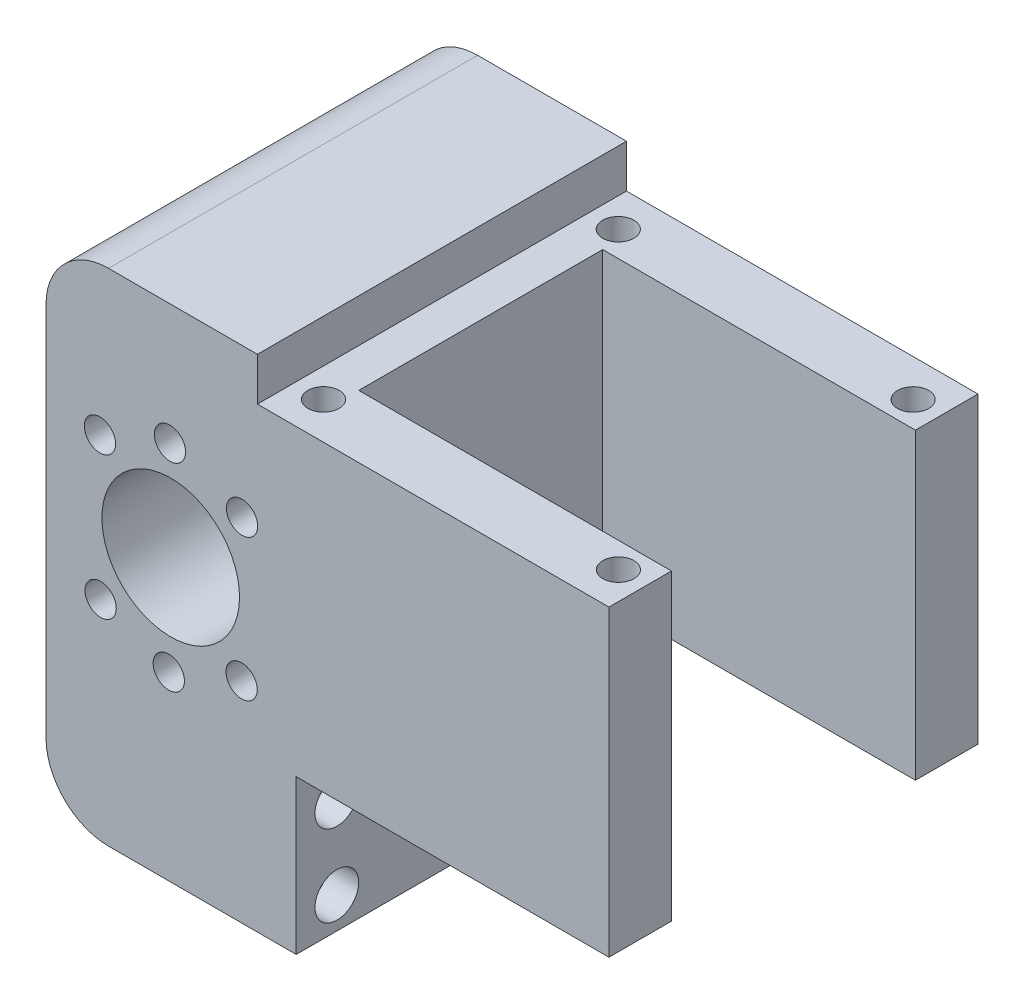
from build123d import *

# Parameters (mm, degrees)
SKETCH1_W                    = 40
SKETCH1_H                    = 80
BOSS_EXTRUDE1_DEPTH          = 59
SKETCH2_R                    = 11
SKETCH2_R_2                  = 2.5
CUT_EXTRUDE1_DEPTH           = 77.829612465
SKETCH5_R                    = 2.55
CUT_EXTRUDE3_DEPTH           = 5
FILLET3_R                    = 10
FILLET4_R                    = 10
F_7_0_7_DIAMETER_HOLE1_D     = 7
F_7_0_7_DIAMETER_HOLE1_DEPTH = 4.896987833
F_7_0_7_DIAMETER_HOLE1_TIP   = 2.103012167
SKETCH13_W                   = 10
SKETCH13_H                   = 48.48
BOSS_EXTRUDE2_DEPTH          = 50
SKETCH18_W                   = 6.2
SKETCH18_H                   = 6.9
CUT_EXTRUDE4_DEPTH           = 103.023881602
F_5_0_5_DIAMETER_HOLE1_D     = 5
F_5_0_5_DIAMETER_HOLE1_DEPTH = 18.497848452
F_5_0_5_DIAMETER_HOLE1_TIP   = 1.502151548


with BuildPart() as part:
    # Sketch1 → Boss-Extrude1 (new body)
    with BuildSketch(Plane.XY):
        with Locations((0.060830656, -4.937205352)):
            Rectangle(SKETCH1_W, SKETCH1_H)
    extrude(amount=BOSS_EXTRUDE1_DEPTH)

    # Sketch2 → Cut-Extrude1 (cut, through all)
    with BuildSketch(Plane.XY):
        Circle(SKETCH2_R)
        with Locations((-11.313708499, 11.313708499)):
            Circle(SKETCH2_R_2)
        with Locations((-0.122338904, 15.759725587)):
            Circle(SKETCH2_R_2)
        with Locations((11.402693442, 11.263696484)):
            Circle(SKETCH2_R_2)
        with Locations((11.339369089, -11.406422087)):
            Circle(SKETCH2_R_2)
        with Locations((-0.312311964, -16.029099896)):
            Circle(SKETCH2_R_2)
        with Locations((-11.204100775, -11.406422087)):
            Circle(SKETCH2_R_2)
    extrude(amount=CUT_EXTRUDE1_DEPTH, mode=Mode.SUBTRACT)

    # Sketch5 → Cut-Extrude3 (cut)
    with BuildSketch(Plane.ZY.offset(19.939169344)):
        with Locations((29.5, -4.937205352)):
            Circle(SKETCH5_R)
        with Locations((39.5, -4.937205352)):
            Circle(SKETCH5_R)
        with Locations((19.5, -4.937205352)):
            Circle(SKETCH5_R)
        with Locations((29.5, 5.062794648)):
            Circle(SKETCH5_R)
        with Locations((29.5, -14.937205352)):
            Circle(SKETCH5_R)
    extrude(amount=-CUT_EXTRUDE3_DEPTH, mode=Mode.SUBTRACT)

    # Fillet3
    fillet3_edges = [part.edges().sort_by_distance(p)[0] for p in [
        (-19.939169344, -44.937205352, 29.5),
    ]]
    fillet(fillet3_edges, radius=FILLET3_R)

    # Fillet4
    fillet4_edges = [part.edges().sort_by_distance(p)[0] for p in [
        (-19.939169344, 35.062794648, 29.5),
    ]]
    fillet(fillet4_edges, radius=FILLET4_R)

    # Ø7.0 (7) Diameter Hole1
    with Locations(Plane(origin=(20.060830656, 0, 0), x_dir=(0, 0, -1), z_dir=(1, 0, 0))):
        with Locations((-52.5, -26.937205352), (-52.5, -39.937205352), (-6.5, -39.937205352), (-6.5, -26.937205352)):
            Hole(F_7_0_7_DIAMETER_HOLE1_D / 2, depth=F_7_0_7_DIAMETER_HOLE1_DEPTH)
            with Locations((0, 0, -(F_7_0_7_DIAMETER_HOLE1_DEPTH + F_7_0_7_DIAMETER_HOLE1_TIP / 2))):  # 118° drill point
                Cone(0, F_7_0_7_DIAMETER_HOLE1_D / 2, F_7_0_7_DIAMETER_HOLE1_TIP, mode=Mode.SUBTRACT)

    # Sketch13 → Boss-Extrude2 (add)
    with BuildSketch(Plane(origin=(20.060830656, 0, 0), x_dir=(0, 0, -1), z_dir=(1, 0, 0))):
        with Locations((-5, 3.922794648)):
            Rectangle(SKETCH13_W, SKETCH13_H)
        with Locations((-54, 3.922794648)):
            Rectangle(SKETCH13_W, SKETCH13_H)
    extrude(amount=BOSS_EXTRUDE2_DEPTH)

    # Sketch18 → Cut-Extrude4 (cut, through all)
    with BuildSketch(Plane(origin=(0, 0, 0), x_dir=(-1, 0, 0), z_dir=(0, 0, -1))):
        with Locations((-16.960830656, 31.612794648)):
            Rectangle(SKETCH18_W, SKETCH18_H)
    extrude(amount=-CUT_EXTRUDE4_DEPTH, mode=Mode.SUBTRACT)

    # Ø5.0 (5) Diameter Hole1
    with Locations(Plane(origin=(0, 28.162794648, 0), x_dir=(1, 0, 0), z_dir=(0, 1, 0))):
        with Locations((18.490830656, -5.94), (65.630830656, -5.94), (65.630830656, -53.06), (18.490830656, -53.06)):
            Hole(F_5_0_5_DIAMETER_HOLE1_D / 2, depth=F_5_0_5_DIAMETER_HOLE1_DEPTH)
            with Locations((0, 0, -(F_5_0_5_DIAMETER_HOLE1_DEPTH + F_5_0_5_DIAMETER_HOLE1_TIP / 2))):  # 118° drill point
                Cone(0, F_5_0_5_DIAMETER_HOLE1_D / 2, F_5_0_5_DIAMETER_HOLE1_TIP, mode=Mode.SUBTRACT)


solid = part.part
